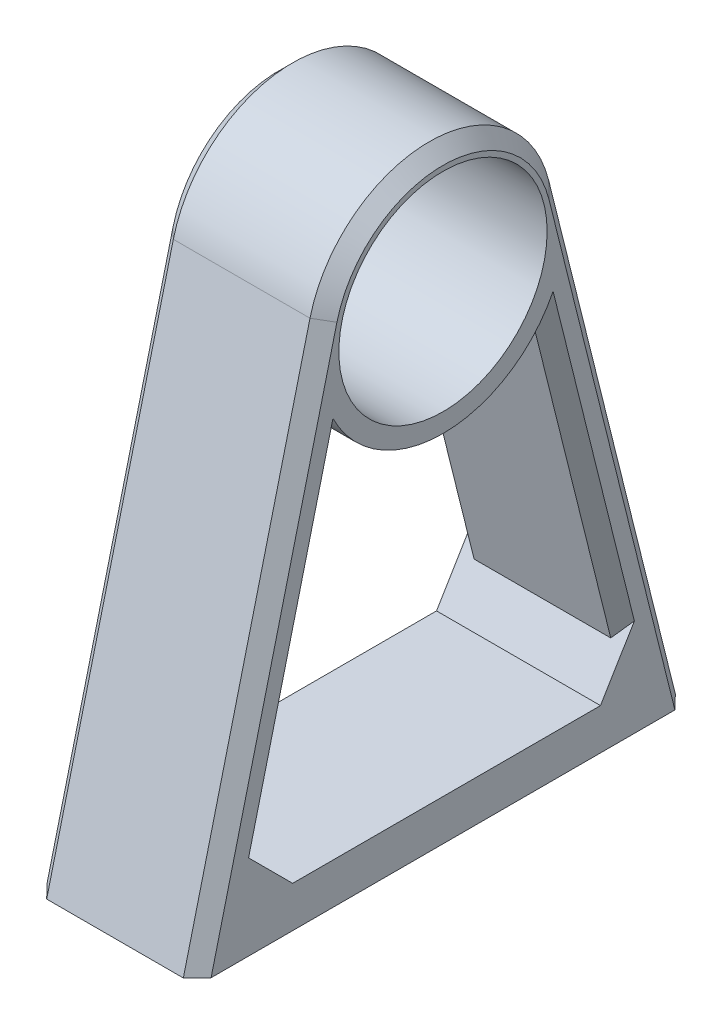
from build123d import *
from OCP.BRepFilletAPI import BRepFilletAPI_MakeChamfer

# Parameters (mm, degrees)
SZKIC1_R                    = 38.1
DODANIE_WYCI_GNI_CIE1_DEPTH = 30
SFAZOWANIE1_SIZE            = 15
SFAZOWANIE1_SIZE2           = 12.374392919
SFAZOWANIE2_SIZE            = 5


with BuildPart() as part:
    # Szkic1 → Dodanie-wyciągnięcie1 (new, symmetric)
    with BuildSketch(Plane(origin=(0, 0, 0), x_dir=(0, 0, -1), z_dir=(1, 0, 0))):
        with BuildLine():
            Line((0, -175), (-90, -175))
            Line((-90, -175), (-43.663859775, 10.884270741))
            ThreePointArc((-43.663859775, 10.884270741), (0, 45), (43.663859775, 10.884270741))
            Line((43.663859775, 10.884270741), (90, -175))
            Line((90, -175), (0, -175))
        make_face()
        Circle(SZKIC1_R, mode=Mode.SUBTRACT)
        with BuildLine():
            Line((0, -160), (70, -160))
            Line((70, -160), (36.631404611, -26.136950783))
            ThreePointArc((36.631404611, -26.136950783), (0, -45), (-36.631404611, -26.136950783))
            Line((-36.631404611, -26.136950783), (-70, -160))
            Line((-70, -160), (0, -160))
        make_face(mode=Mode.SUBTRACT)
    extrude(amount=DODANIE_WYCI_GNI_CIE1_DEPTH, both=True)

    # Sfazowanie1: one chamfer whose edges measure the first distance from different faces: ONE call of the kernel's chamfer builder (chamfer() names one face for all edges)
    sfazowanie1_edges_1 = [part.edges().sort_by_distance(p)[0] for p in [
        (0, -160, 70),
    ]]
    sfazowanie1_side_1 = [part.faces().sort_by_distance(p)[0] for p in [
        (0, -160, 0),
    ]]
    sfazowanie1_edges_2 = [part.edges().sort_by_distance(p)[0] for p in [
        (0, -160, -70),
    ]]
    sfazowanie1_side_2 = [part.faces().sort_by_distance(p)[0] for p in [
        (0, -93.068475391, -53.315702306),
    ]]
    sfazowanie1 = BRepFilletAPI_MakeChamfer(part.part.solid().wrapped)
    for e in sfazowanie1_edges_1:
        sfazowanie1.Add(SFAZOWANIE1_SIZE, SFAZOWANIE1_SIZE2, e.wrapped, sfazowanie1_side_1[0].wrapped)  # the first distance lies on this face
    for e in sfazowanie1_edges_2:
        sfazowanie1.Add(SFAZOWANIE1_SIZE, SFAZOWANIE1_SIZE2, e.wrapped, sfazowanie1_side_2[0].wrapped)  # the first distance lies on this face
    add(Compound.cast(sfazowanie1.Shape()), mode=Mode.REPLACE)

    # Sfazowanie2
    sfazowanie2_edges = [part.edges().sort_by_distance(p)[0] for p in [
        (30, -82.057864629, -66.831929887),
        (30, 45, 0),
        (30, -82.057864629, 66.831929887),
        (-30, -82.057864629, -66.831929887),
        (-30, 45, 0),
        (-30, -82.057864629, 66.831929887),
        (-30, -87.0649892, 51.819188497),
        (-30, -85.791165429, -51.501657182),
        (30, -85.791165429, -51.501657182),
        (30, -87.0649892, 51.819188497),
    ]]
    chamfer(sfazowanie2_edges, length=SFAZOWANIE2_SIZE)


solid = part.part
